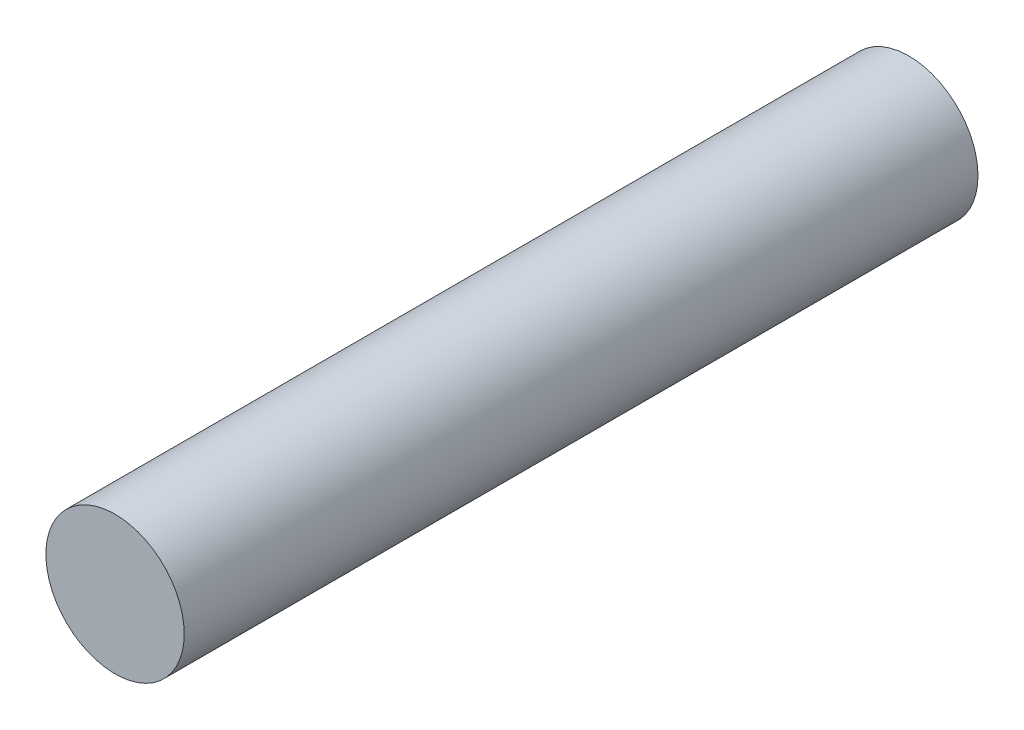
from build123d import *

# Parameters (mm, degrees)
SKETCH1_R           = 1.2
BOSS_EXTRUDE1_DEPTH = 13.77
SCALE_1_SCALE       = 2


with BuildPart() as part:
    # Sketch1 → Boss-Extrude1 (new body)
    with BuildSketch(Plane.XY):
        Circle(SKETCH1_R)
    extrude(amount=BOSS_EXTRUDE1_DEPTH)


with BuildPart() as part_1:
    # 缩放比例1: scaled about (0, 0, 6.885)
    add(part.part.scale(SCALE_1_SCALE).moved(Location((0, 0, -6.885))))


solid = part_1.part
